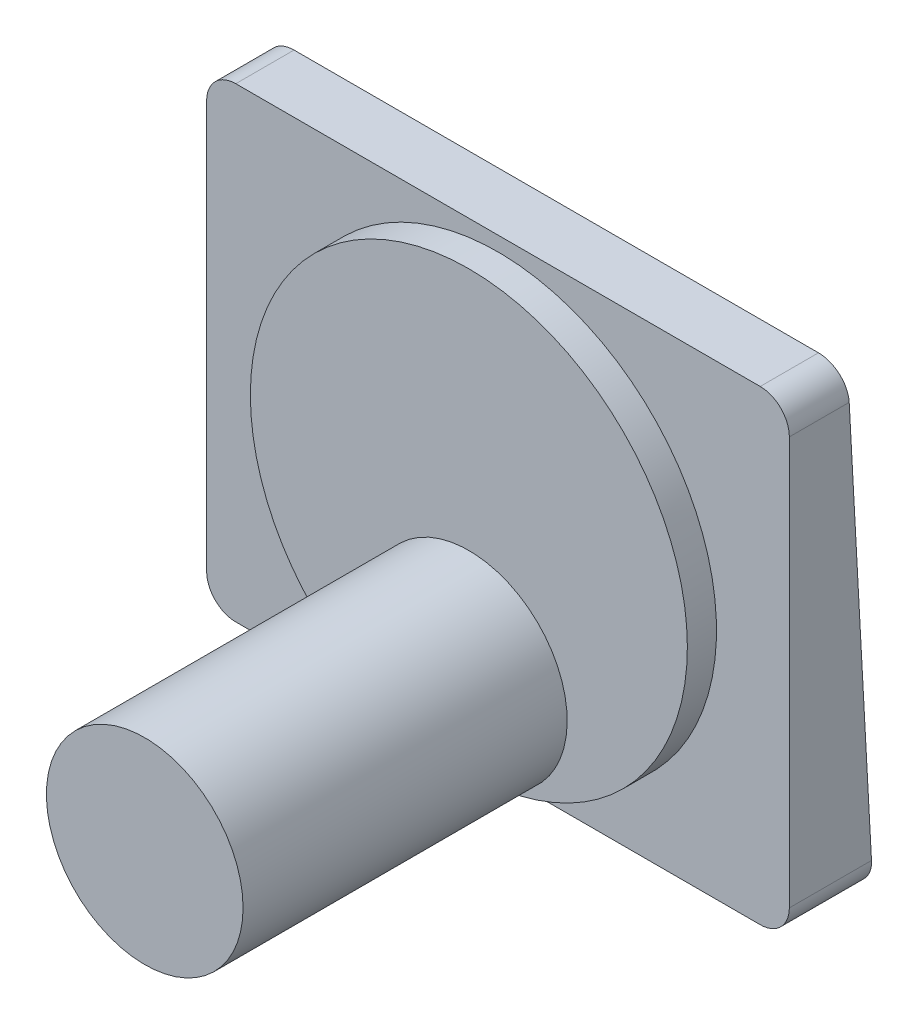
from build123d import *

# Parameters (mm, degrees)
BOSS_EXTRUDE1_DEPTH = 40
FILLET1_R           = 4
SKETCH2_R           = 30
BOSS_EXTRUDE2_DEPTH = 4
SKETCH3_R           = 13.5
BOSS_EXTRUDE3_DEPTH = 44.5


with BuildPart() as part:
    # Sketch1 → Boss-Extrude1 (new, symmetric)
    with BuildSketch(Plane(origin=(0, 0, 0), x_dir=(0, 0, -1), z_dir=(1, 0, 0))):
        Polygon((0, 32), (0, -32), (11.5, -32), (8, 32), align=None)
    extrude(amount=BOSS_EXTRUDE1_DEPTH, both=True)

    # Fillet1
    fillet1_edges = [part.edges().sort_by_distance(p)[0] for p in [
        (40, -32, -5.75),
        (40, 32, -4),
        (-40, -32, -5.75),
        (-40, 32, -4),
    ]]
    fillet(fillet1_edges, radius=FILLET1_R)

    # Sketch2 → Boss-Extrude2 (add)
    with BuildSketch(Plane.XY):
        with Locations(Location((0, 0, 0), (0, 0, 180))):
            Circle(SKETCH2_R)
    extrude(amount=BOSS_EXTRUDE2_DEPTH)

    # Sketch3 → Boss-Extrude3 (add)
    with BuildSketch(Plane.XY.offset(4)):
        with Locations(Location((0, -17, 0), (0, 0, 249.082562466))):
            Circle(SKETCH3_R)
    extrude(amount=BOSS_EXTRUDE3_DEPTH)


solid = part.part
